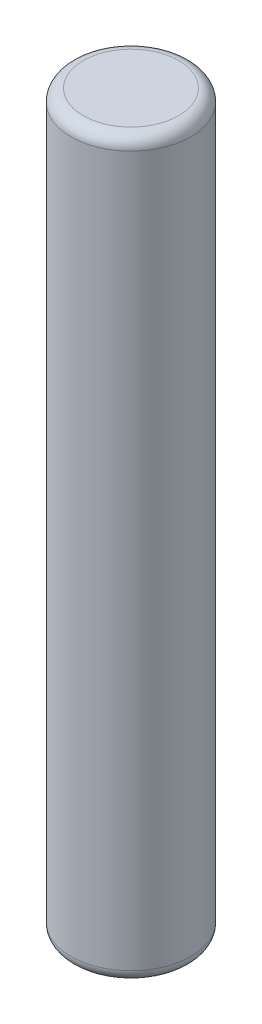
from build123d import *

# Parameters (mm, degrees)
SKETCH1_R           = 2.45
BOSS_EXTRUDE1_DEPTH = 30
FILLET1_R           = 0.5


with BuildPart() as part:
    # Sketch1 → Boss-Extrude1 (new body)
    with BuildSketch(Plane(origin=(0, 0, 0), x_dir=(1, 0, 0), z_dir=(0, 1, 0))):
        with Locations(Location((0, 0, 0), (0, 0, 270))):
            Circle(SKETCH1_R)
    extrude(amount=BOSS_EXTRUDE1_DEPTH)

    # Fillet1
    fillet1_edges = [part.edges().sort_by_distance(p)[0] for p in [
        (0, 0, -2.45),
        (0, 30, -2.45),
    ]]
    fillet(fillet1_edges, radius=FILLET1_R)


solid = part.part
